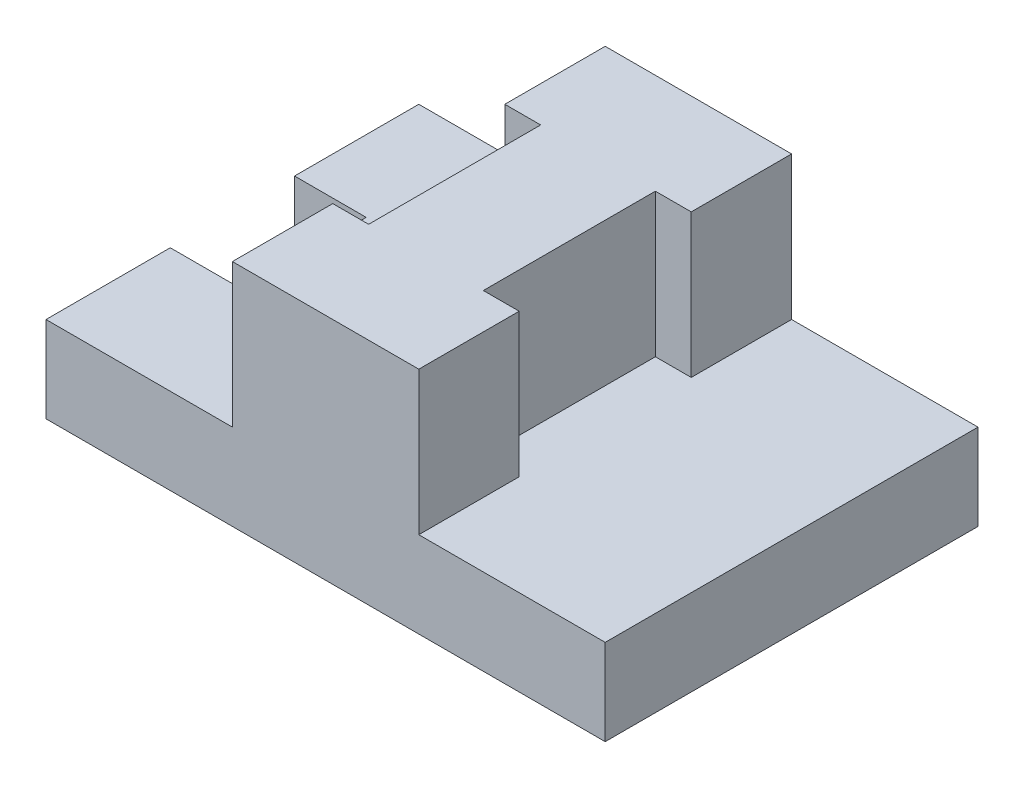
from build123d import *

# Parameters (mm, degrees)
BOSS_EXTRUDE5_DEPTH   = 12
BOSS_EXTRUDE5_2_DEPTH = 12
BOSS_EXTRUDE6_DEPTH   = 32


with BuildPart() as part:
    # Sketch6 → Boss-Extrude5 (new body)
    with BuildSketch(Plane(origin=(0, 0, 0), x_dir=(1, 0, 0), z_dir=(0, 1, 0))):
        Polygon((-26.75977594, 29.975997565), (-52.75977594, 29.975997565), (-52.75977594, 12.642664232), (-42.75977594, 12.642664232), (-42.75977594, -4.690669102), (-52.75977594, -4.690669102), (-52.75977594, -22.024002435), (-26.75977594, -22.024002435), (-26.75977594, -8.024002435), (-21.75977594, -8.024002435), (-21.75977594, 15.975997565), (-26.75977594, 15.975997565), align=None)
    extrude(amount=BOSS_EXTRUDE5_DEPTH)



with BuildPart() as body_2:
    # Sketch6 → Boss-Extrude5 2 (new body)
    with BuildSketch(Plane(origin=(0, 0, 0), x_dir=(1, 0, 0), z_dir=(0, 1, 0))):
        Polygon((25.24022406, 29.975997565), (-0.75977594, 29.975997565), (-0.75977594, 15.975997565), (-5.75977594, 15.975997565), (-5.75977594, -8.024002435), (-0.75977594, -8.024002435), (-0.75977594, -22.024002435), (25.24022406, -22.024002435), align=None)
    extrude(amount=BOSS_EXTRUDE5_2_DEPTH)


with BuildPart() as part_1:
    add(part.part)

    add(body_2.part)  # Boss-Extrude6 merges body 2
    # Sketch6<3> → Boss-Extrude6 (add)
    with BuildSketch(Plane(origin=(0, 0, 0), x_dir=(1, 0, 0), z_dir=(0, 1, 0))):
        Polygon((-0.75977594, 29.975997565), (-26.75977594, 29.975997565), (-26.75977594, 15.975997565), (-21.75977594, 15.975997565), (-21.75977594, -8.024002435), (-26.75977594, -8.024002435), (-26.75977594, -22.024002435), (-0.75977594, -22.024002435), (-0.75977594, -8.024002435), (-5.75977594, -8.024002435), (-5.75977594, 15.975997565), (-0.75977594, 15.975997565), align=None)
    extrude(amount=BOSS_EXTRUDE6_DEPTH)


solid = part_1.part
